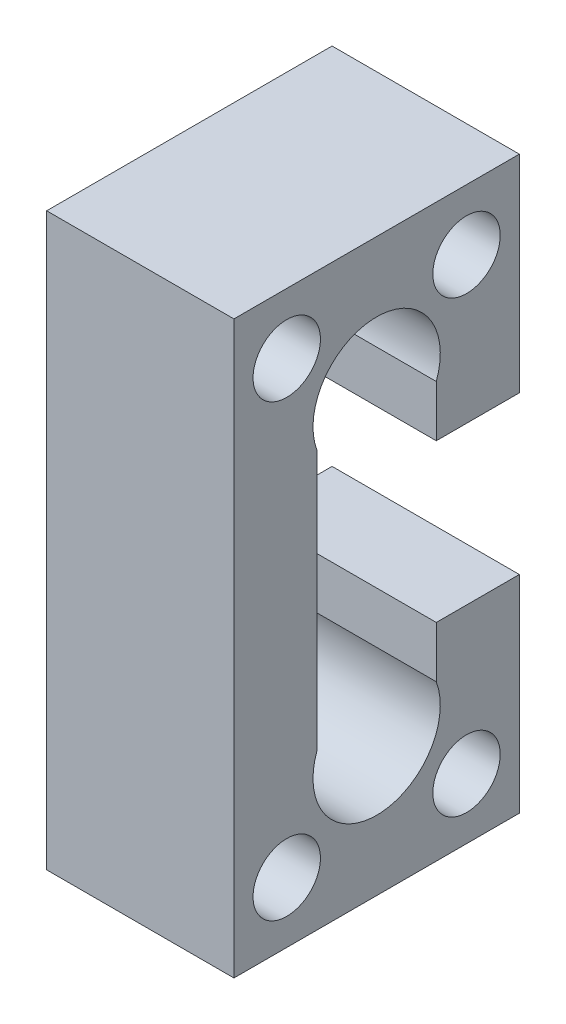
from build123d import *

# Parameters (mm, degrees)
SKETCH1_W             = 25
SKETCH1_H             = 76.2
EXTRUDE1_DEPTH        = 19.05
M16_CLEARANCE_HOLE1_D = 16.9926
EXTRUDE3_DEPTH        = 50.39142132
M8_CLEARANCE_HOLE1_D  = 9


with BuildPart() as part:
    # Sketch1 → Extrude1 (new, symmetric)
    with BuildSketch(Plane.XY):
        Rectangle(SKETCH1_W, SKETCH1_H)
    extrude(amount=EXTRUDE1_DEPTH, both=True)

    # M16 Clearance Hole1 (through all)
    with Locations(Plane.ZY.offset(12.5)):
        with Locations((0, -20.32), (0, 20.32)):
            Hole(M16_CLEARANCE_HOLE1_D / 2)

    # Sketch2 → Extrude3 (cut, through all)
    with BuildSketch(Plane(origin=(12.5, 0, 0), x_dir=(0, 0, -1), z_dir=(1, 0, 0))):
        Polygon((19.05, 10.5), (7.9629, 10.5), (7.9629, 20), (-7.9629, 20), (-7.9629, -20), (7.9629, -20), (7.9629, -10.5), (19.05, -10.5), align=None)
    extrude(amount=-EXTRUDE3_DEPTH, mode=Mode.SUBTRACT)

    # M8 Clearance Hole1 (through all)
    with Locations(Plane(origin=(12.5, 0, 0), x_dir=(0, 0, -1), z_dir=(1, 0, 0))):
        with Locations((-12, 30), (12, 30), (12, -30), (-12, -30)):
            Hole(M8_CLEARANCE_HOLE1_D / 2)


solid = part.part
